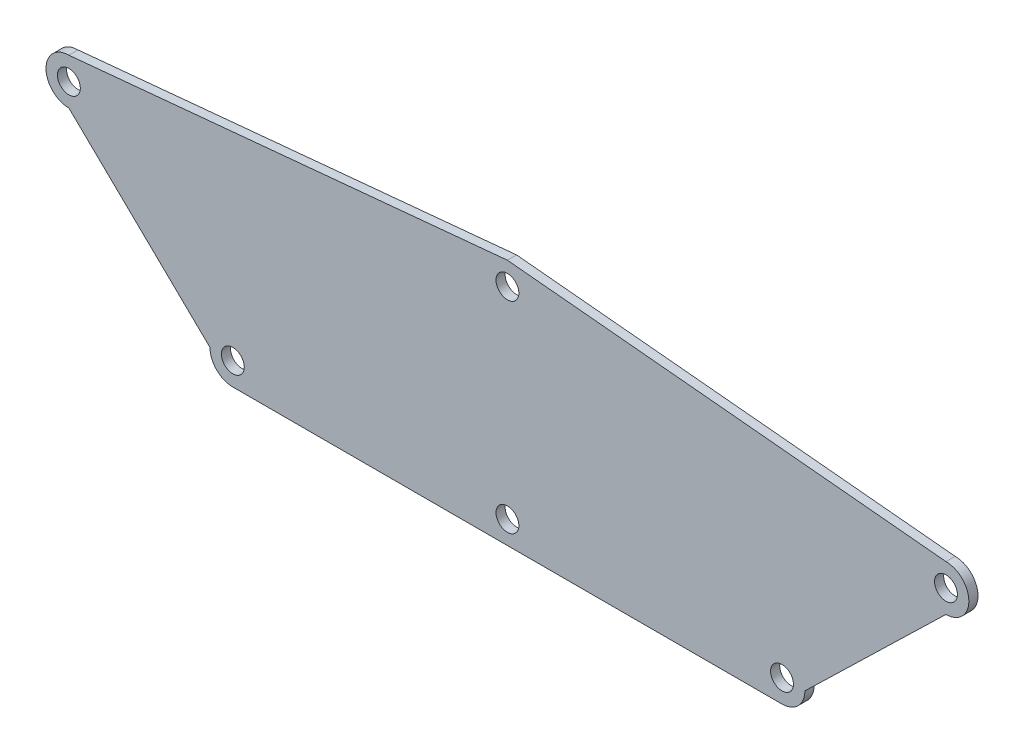
from build123d import *

# Parameters (mm, degrees)
SKETCH1_R           = 2.5
BOSS_EXTRUDE1_DEPTH = 2


with BuildPart() as part:
    # Sketch1 → Boss-Extrude1 (new body)
    with BuildSketch(Plane.XY):
        with BuildLine():
            ThreePointArc((-95.826370741, 39.877946607), (-100.826370741, 34.877946607), (-95.826370741, 29.877946607))
            Line((-95.826370741, 29.877946607), (-65, 0))
            ThreePointArc((-65, 0), (-63.535533906, -3.535533906), (-60, -5))
            Line((-60, -5), (60, -5))
            ThreePointArc((60, -5), (63.535533906, -3.535533906), (65, 0))
            Line((65, 0), (95.826370741, 29.877946607))
            ThreePointArc((95.826370741, 29.877946607), (100.826370741, 34.877946607), (95.826370741, 39.877946607))
            Line((95.826370741, 39.877946607), (0, 49))
            Line((0, 49), (-95.826370741, 39.877946607))
        make_face()
        Circle(SKETCH1_R, mode=Mode.SUBTRACT)
        with Locations((-95.826370741, 34.877946607)):
            Circle(SKETCH1_R, mode=Mode.SUBTRACT)
        with Locations((0, 44)):
            Circle(SKETCH1_R, mode=Mode.SUBTRACT)
        with Locations((-60, 0)):
            Circle(SKETCH1_R, mode=Mode.SUBTRACT)
        with Locations((95.826370741, 34.877946607)):
            Circle(SKETCH1_R, mode=Mode.SUBTRACT)
        with Locations((60, 0)):
            Circle(SKETCH1_R, mode=Mode.SUBTRACT)
    extrude(amount=BOSS_EXTRUDE1_DEPTH)


solid = part.part
